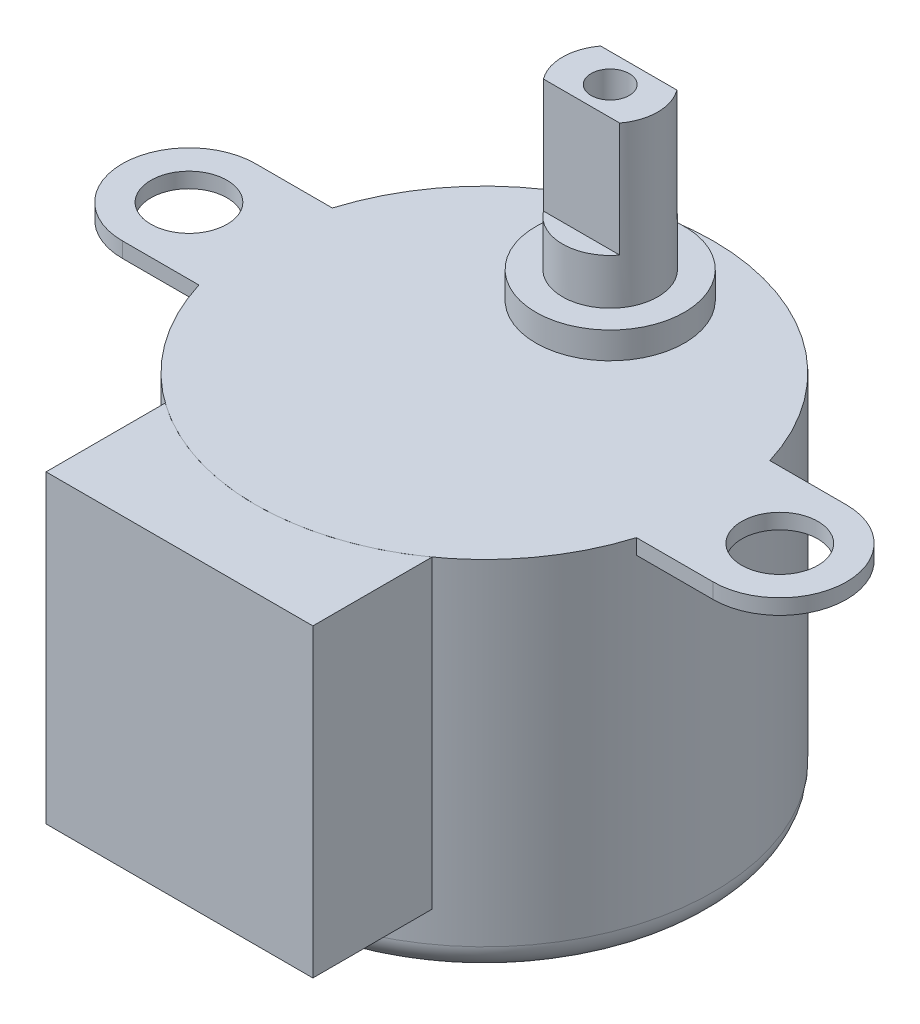
from build123d import *

# Parameters (mm, degrees)
SKETCH1_R           = 12
BOSS_EXTRUDE1_DEPTH = 19
BOSS_EXTRUDE2_DEPTH = 16
BOSS_EXTRUDE3_START = -0.8
BOSS_EXTRUDE3_DEPTH = 0.8
SKETCH4_R           = 2
CUT_EXTRUDE1_DEPTH  = 32.272991542
SKETCH5_R           = 3.9
BOSS_EXTRUDE4_DEPTH = 1.4
SKETCH6_R           = 2.5
BOSS_EXTRUDE5_DEPTH = 8.4
CUT_EXTRUDE2_DEPTH  = 6
SKETCH8_R           = 1
CUT_EXTRUDE3_DEPTH  = 6
FILLET2_R           = 1.4


with BuildPart() as part:
    # Sketch1 → Boss-Extrude1 (new body)
    with BuildSketch(Plane(origin=(0, 0, 0), x_dir=(1, 0, 0), z_dir=(0, 1, 0))):
        with Locations(Location((0, 0, 0), (0, 0, 270))):
            Circle(SKETCH1_R)
    extrude(amount=BOSS_EXTRUDE1_DEPTH)

    # Sketch3 → Boss-Extrude3 (add)
    with BuildSketch(Plane(origin=(0, 19, 0), x_dir=(1, 0, 0), z_dir=(0, 1, 0)).offset(BOSS_EXTRUDE3_START)):
        with BuildLine():
            ThreePointArc((-12, 0), (-13.025126266, 2.474873734), (-15.5, 3.5))
            Line((-15.5, 3.5), (-15.5, -3.5))
            ThreePointArc((-15.5, -3.5), (-13.025126266, -2.474873734), (-12, 0))
        make_face()
        with BuildLine():
            Line((-15.5, -3.5), (-15.5, 3.5))
            ThreePointArc((-15.5, 3.5), (-19, 0), (-15.5, -3.5))
        make_face()
        with BuildLine():
            Line((11.478240283, 3.5), (-11.478240283, 3.5))
            ThreePointArc((-11.478240283, 3.5), (-11.868843318, 1.769338379), (-12, 0))
            ThreePointArc((-12, 0), (-11.868843318, -1.769338379), (-11.478240283, -3.5))
            Line((-11.478240283, -3.5), (11.478240283, -3.5))
            ThreePointArc((11.478240283, -3.5), (11.868843318, -1.769338379), (12, 0))
            ThreePointArc((12, 0), (11.868843318, 1.769338379), (11.478240283, 3.5))
        make_face()
        with BuildLine():
            ThreePointArc((-12, 0), (-13.025126266, -2.474873734), (-15.5, -3.5))
            Line((-15.5, -3.5), (-11.478240283, -3.5))
            ThreePointArc((-11.478240283, -3.5), (-11.868843318, -1.769338379), (-12, 0))
        make_face()
        with BuildLine():
            Line((-11.478240283, 3.5), (-15.5, 3.5))
            ThreePointArc((-15.5, 3.5), (-13.025126266, 2.474873734), (-12, 0))
            ThreePointArc((-12, 0), (-11.868843318, 1.769338379), (-11.478240283, 3.5))
        make_face()
        with BuildLine():
            Line((15.5, 3.5), (11.478240283, 3.5))
            ThreePointArc((11.478240283, 3.5), (11.868843318, 1.769338379), (12, 0))
            ThreePointArc((12, 0), (13.025126266, 2.474873734), (15.5, 3.5))
        make_face()
        with BuildLine():
            ThreePointArc((15.5, -3.5), (13.025126266, -2.474873734), (12, 0))
            ThreePointArc((12, 0), (11.868843318, -1.769338379), (11.478240283, -3.5))
            Line((11.478240283, -3.5), (15.5, -3.5))
        make_face()
        with BuildLine():
            ThreePointArc((19, 0), (17.974873734, 2.474873734), (15.5, 3.5))
            Line((15.5, 3.5), (15.5, -3.5))
            ThreePointArc((15.5, -3.5), (17.974873734, -2.474873734), (19, 0))
        make_face()
        with BuildLine():
            Line((15.5, -3.5), (15.5, 3.5))
            ThreePointArc((15.5, 3.5), (13.025126266, 2.474873734), (12, 0))
            ThreePointArc((12, 0), (13.025126266, -2.474873734), (15.5, -3.5))
        make_face()
    extrude(amount=BOSS_EXTRUDE3_DEPTH)

    # Sketch4 → Cut-Extrude1 (cut, through all)
    with BuildSketch(Plane(origin=(0, 19, 0), x_dir=(1, 0, 0), z_dir=(0, 1, 0))):
        with Locations(Location((15.5, 0, 0), (0, 0, 270))):
            Circle(SKETCH4_R)
        with Locations(Location((-15.5, 0, 0), (0, 0, 270))):
            Circle(SKETCH4_R)
    extrude(amount=-CUT_EXTRUDE1_DEPTH, mode=Mode.SUBTRACT)

    # Sketch5 → Boss-Extrude4 (add)
    with BuildSketch(Plane(origin=(0, 19, 0), x_dir=(1, 0, 0), z_dir=(0, 1, 0))):
        with Locations(Location((0, 6.6, 0), (0, 0, 270))):
            Circle(SKETCH5_R)
    extrude(amount=BOSS_EXTRUDE4_DEPTH)

    # Fillet2
    fillet2_edges = [part.edges().sort_by_distance(p)[0] for p in [
        (0, 0, -12),
    ]]
    fillet(fillet2_edges, radius=FILLET2_R)


with BuildPart() as body_2:
    # Sketch2 → Boss-Extrude2 (new body)
    with BuildSketch(Plane(origin=(0, 19, 0), x_dir=(1, 0, 0), z_dir=(0, 1, 0))):
        with BuildLine():
            ThreePointArc((7, -9.746794345), (0, -12), (-7, -9.746794345))
            Line((-7, -9.746794345), (-7, -16))
            Line((-7, -16), (7, -16))
            Line((7, -16), (7, -9.746794345))
        make_face()
    extrude(amount=-BOSS_EXTRUDE2_DEPTH)


with BuildPart() as body_3:
    # Sketch6 → Boss-Extrude5 (new body)
    with BuildSketch(Plane(origin=(0, 20.4, 0), x_dir=(1, 0, 0), z_dir=(0, 1, 0))):
        with Locations(Location((0, 6.6, 0), (0, 0, 270))):
            Circle(SKETCH6_R)
    extrude(amount=BOSS_EXTRUDE5_DEPTH)

    # Sketch7 → Cut-Extrude2 (cut)
    with BuildSketch(Plane(origin=(0, 28.8, 0), x_dir=(1, 0, 0), z_dir=(0, 1, 0))):
        with BuildLine():
            ThreePointArc((2, 8.1), (0, 9.1), (-2, 8.1))
            Line((-2, 8.1), (2, 8.1))
        make_face()
        with BuildLine():
            Line((2, 5.1), (-2, 5.1))
            ThreePointArc((-2, 5.1), (0, 4.1), (2, 5.1))
        make_face()
    extrude(amount=-CUT_EXTRUDE2_DEPTH, mode=Mode.SUBTRACT)

    # Sketch8 → Cut-Extrude3 (cut)
    with BuildSketch(Plane(origin=(0, 28.8, 0), x_dir=(1, 0, 0), z_dir=(0, 1, 0))):
        with Locations(Location((0, 6.6, 0), (0, 0, 270))):
            Circle(SKETCH8_R)
    extrude(amount=-CUT_EXTRUDE3_DEPTH, mode=Mode.SUBTRACT)


solid = Compound([part.part, body_2.part, body_3.part])
